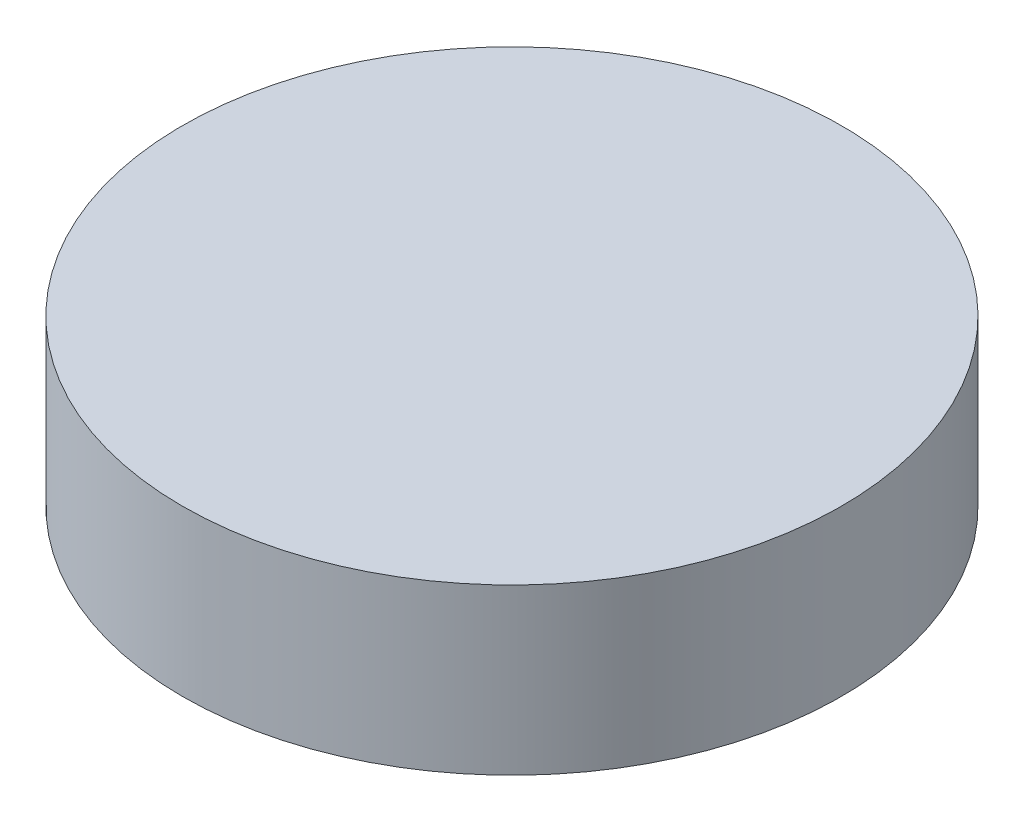
from build123d import *

# Parameters (mm, degrees)
SKETCH1_R           = 10
BOSS_EXTRUDE1_DEPTH = 5
SKETCH2_R           = 7.65
CUT_EXTRUDE1_DEPTH  = 3


with BuildPart() as part:
    # Sketch1 → Boss-Extrude1 (new body)
    with BuildSketch(Plane(origin=(0, 0, 0), x_dir=(1, 0, 0), z_dir=(0, 1, 0))):
        with Locations(Location((0, 0, 0), (0, 0, 270))):
            Circle(SKETCH1_R)
    extrude(amount=BOSS_EXTRUDE1_DEPTH)

    # Sketch2 → Cut-Extrude1 (cut)
    with BuildSketch(Plane.XZ):
        with Locations(Location((0, 0, 0), (0, 0, 270))):
            Circle(SKETCH2_R)
    extrude(amount=-CUT_EXTRUDE1_DEPTH, mode=Mode.SUBTRACT)


solid = part.part
